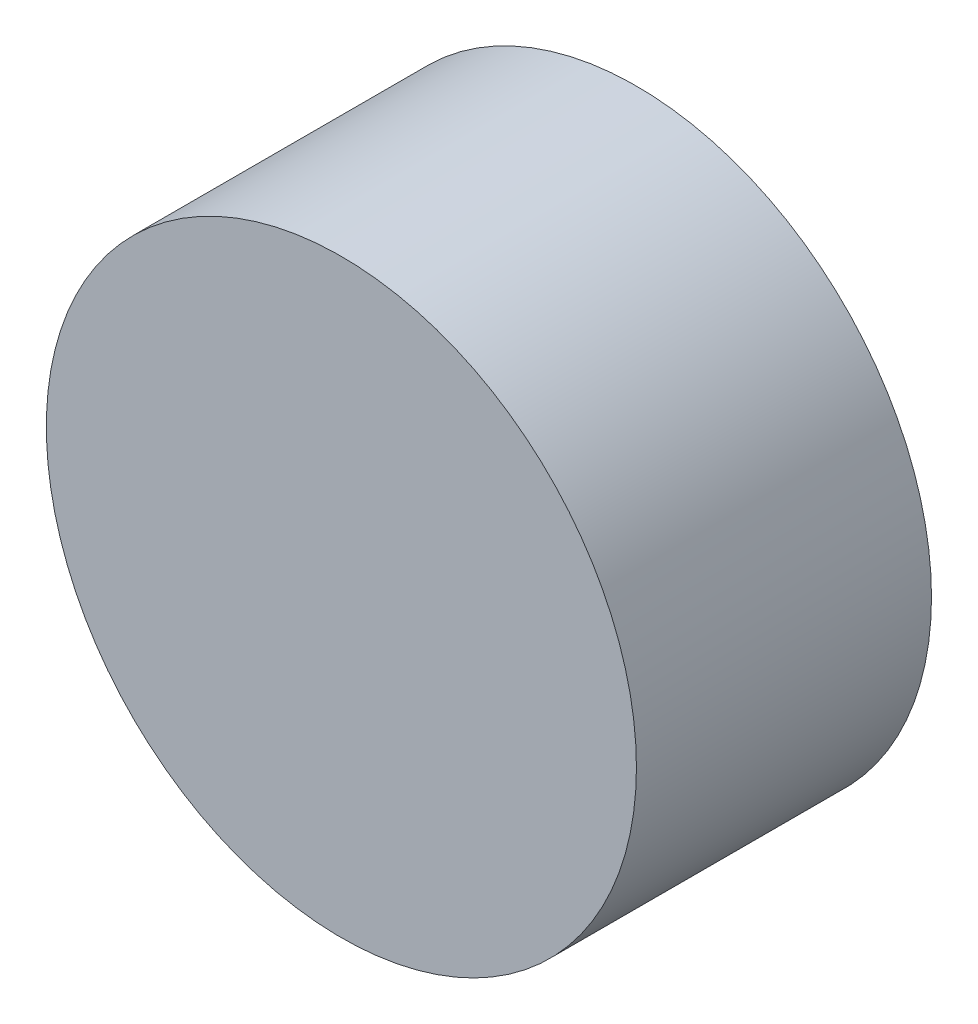
from build123d import *

# Parameters (mm, degrees)
SKETCH1_R           = 5.08
BOSS_EXTRUDE1_DEPTH = 5.08


with BuildPart() as part:
    # Sketch1 → Boss-Extrude1 (new body)
    with BuildSketch(Plane.XY):
        Circle(SKETCH1_R)
    extrude(amount=BOSS_EXTRUDE1_DEPTH)


solid = part.part
